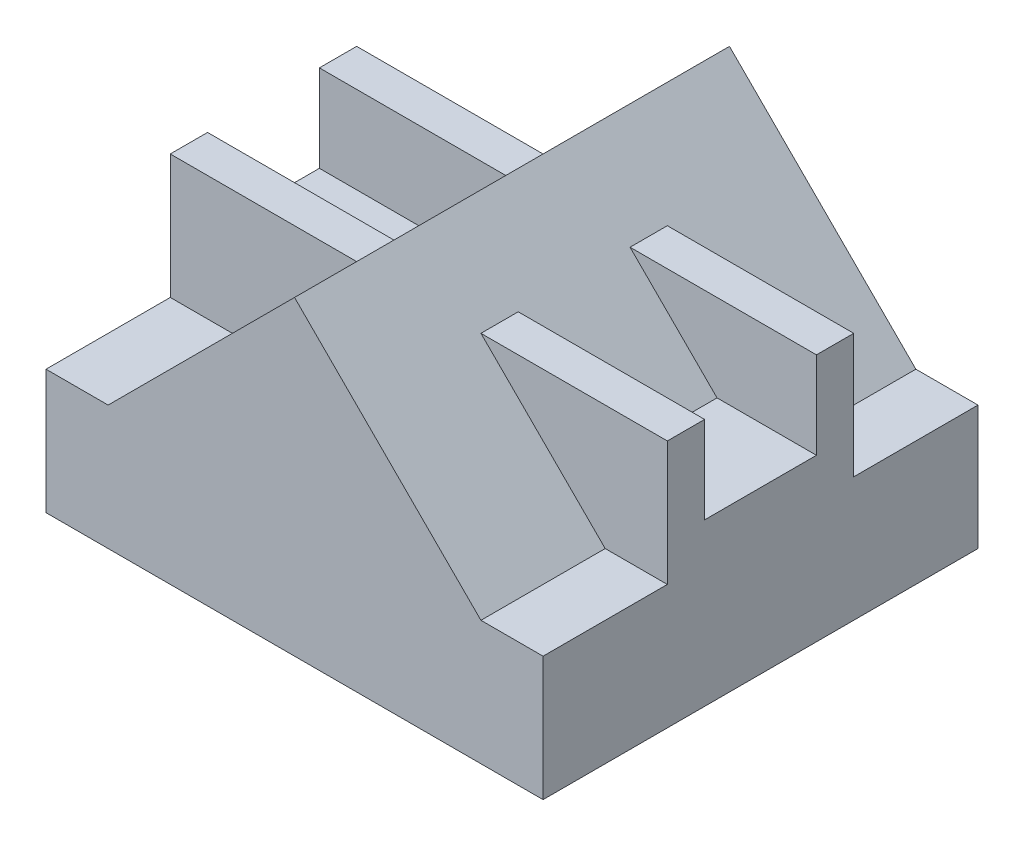
from build123d import *

# Parameters (mm, degrees)
BOSS_EXTRUDE1_DEPTH = 87.5
CUT_EXTRUDE1_REACH  = 253.558
CUT_EXTRUDE2_REACH  = 253.558


with BuildPart() as part:
    # Sketch1 → Boss-Extrude1 (new, symmetric)
    with BuildSketch(Plane.XY):
        Polygon((-100, 0), (100, 0), (100, 100), (25, 100), (0, 125), (-25, 100), (-100, 100), align=None)
    extrude(amount=BOSS_EXTRUDE1_DEPTH, both=True)

    # Cut-Extrude1: up to this plane
    cut_extrude1_end = Plane(origin=(25, 100, 87.5), z_dir=(-0.7071067811865489, -0.7071067811865461, 0))
    # Sketch2 → Cut-Extrude1 (cut, up to the surface)
    with BuildSketch(Plane(origin=(100, 0, 0), x_dir=(0, 0, -1), z_dir=(1, 0, 0)), mode=Mode.PRIVATE) as cut_extrude1_sk1:
        Polygon((-87.5, 125), (-87.5, 50), (-37.5, 50), (-37.5, 100), (-22.5, 100), (-22.5, 65), (22.5, 65), (22.5, 100), (37.5, 100), (37.5, 50), (87.5, 50), (87.5, 125), align=None)
    cut_extrude1_tool1 = split(extrude(cut_extrude1_sk1.sketch, amount=-CUT_EXTRUDE1_REACH, mode=Mode.PRIVATE), bisect_by=cut_extrude1_end, keep=Keep.BOTH, mode=Mode.PRIVATE)
    add(cut_extrude1_tool1.solids().sort_by_distance((100, 91.061644, 0))[0], mode=Mode.SUBTRACT)

    # Cut-Extrude2: up to this plane
    cut_extrude2_end = Plane(origin=(0, 125, 87.5), z_dir=(0.7071067811865489, -0.7071067811865461, 0))
    # Sketch3 → Cut-Extrude2 (cut, up to the surface)
    with BuildSketch(Plane.ZY.offset(100), mode=Mode.PRIVATE) as cut_extrude2_sk1:
        Polygon((-22.5, 100), (-22.5, 65), (22.5, 65), (22.5, 100), (37.5, 100), (37.5, 50), (87.5, 50), (87.5, 125), (-87.5, 125), (-87.5, 50), (-37.5, 50), (-37.5, 100), align=None)
    cut_extrude2_tool1 = split(extrude(cut_extrude2_sk1.sketch, amount=-CUT_EXTRUDE2_REACH, mode=Mode.PRIVATE), bisect_by=cut_extrude2_end, keep=Keep.BOTH, mode=Mode.PRIVATE)
    add(cut_extrude2_tool1.solids().sort_by_distance((-100, 91.061644, 0))[0], mode=Mode.SUBTRACT)


solid = part.part
